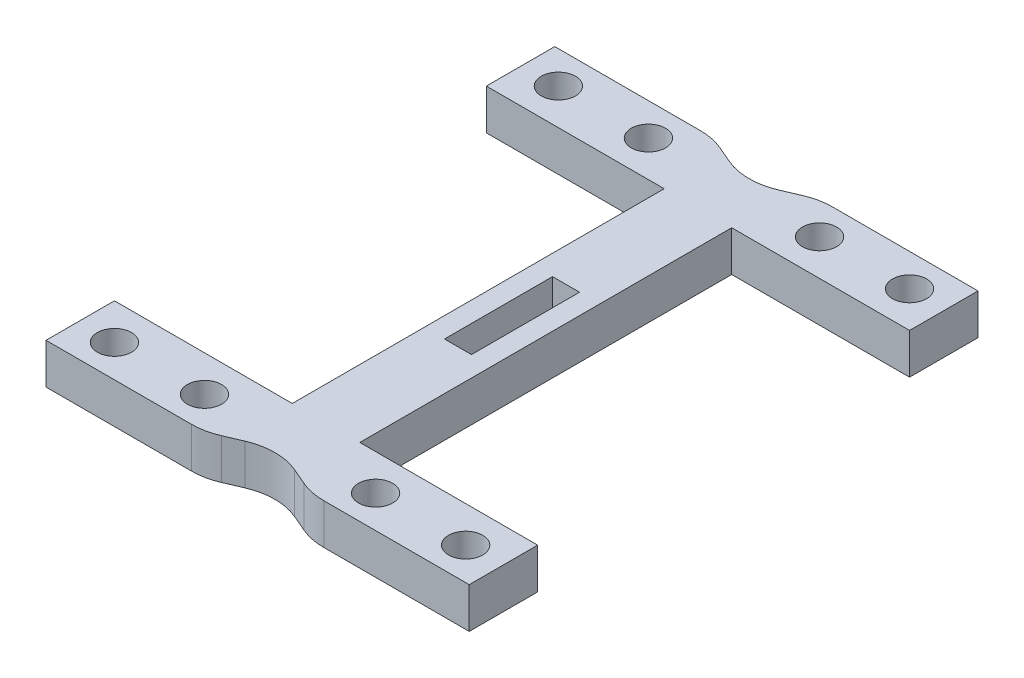
from build123d import *

# Parameters (mm, degrees)
SKETCH1_R           = 1.9
BOSS_EXTRUDE1_DEPTH = 4.5
FILLET1_R           = 7


with BuildPart() as part:
    # Sketch1 → Boss-Extrude1 (new body)
    with BuildSketch(Plane(origin=(0, 0, 0), x_dir=(1, 0, 0), z_dir=(0, 1, 0))):
        Polygon((0, 0), (17.587865182, 0), (23.5, 2.533671894), (29.412134818, 0), (47, 0), (47, 7.6), (27.25, 7.6), (27.25, 28.25), (25, 28.25), (25, 22.25), (22, 22.25), (22, 28.25), (19.75, 28.25), (19.75, 7.6), (0, 7.6), align=None)
        with Locations(Location((4, 3.6, 0), (0, 0, 270))):
            Circle(SKETCH1_R, mode=Mode.SUBTRACT)
        with Locations(Location((14, 3.6, 0), (0, 0, 270))):
            Circle(SKETCH1_R, mode=Mode.SUBTRACT)
        with Locations(Location((33, 3.6, 0), (0, 0, 270))):
            Circle(SKETCH1_R, mode=Mode.SUBTRACT)
        with Locations(Location((43, 3.6, 0), (0, 0, 270))):
            Circle(SKETCH1_R, mode=Mode.SUBTRACT)
    boss_extrude1 = extrude(amount=BOSS_EXTRUDE1_DEPTH)

    # Mirror1: Boss-Extrude1 across plane
    add(boss_extrude1.mirror(Plane(origin=(19.75, 4.5, -28.25), x_dir=(1, 0, 0), z_dir=(0, 0, 1))))

    # Fillet1
    fillet1_edges = [part.edges().sort_by_distance(p)[0] for p in [
        (29.412134818, 2.25, 0),
        (23.5, 2.25, -2.533671894),
        (17.587865182, 2.25, 0),
        (29.412134818, 2.25, -56.5),
        (23.5, 2.25, -53.966328106),
        (17.587865182, 2.25, -56.5),
    ]]
    fillet(fillet1_edges, radius=FILLET1_R)


solid = part.part
